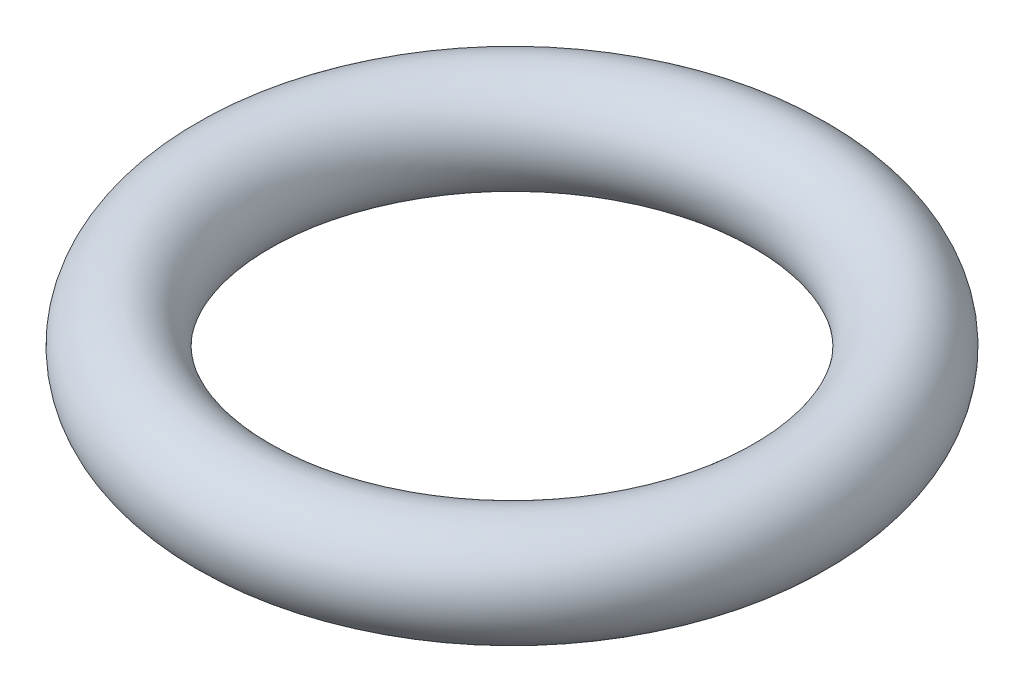
from build123d import *

# Parameters (mm, degrees)
SKETCH1_R = 0.865


with BuildPart() as part:
    # Sketch1 → Revolve1 (revolve)
    with BuildSketch(Plane.XY):
        with Locations((4.69, 0)):
            Circle(SKETCH1_R)
    revolve(axis=Axis((0, 0, 0), (0, 1, 0)))


solid = part.part
